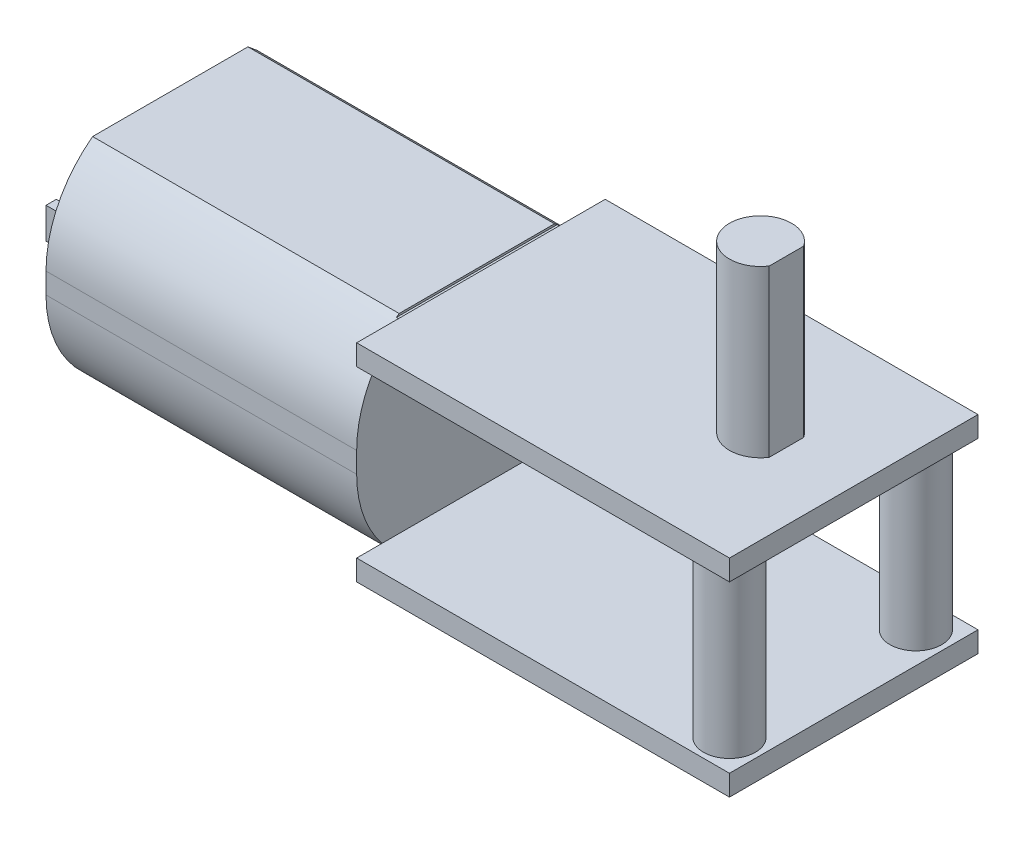
from build123d import *

# Parameters (mm, degrees)
SKETCH1_W           = 18
SKETCH1_H           = 12
BOSS_EXTRUDE1_DEPTH = 1
SKETCH2_R           = 1.25
BOSS_EXTRUDE2_DEPTH = 8
SKETCH3_W           = 18
SKETCH3_H           = 12
BOSS_EXTRUDE3_DEPTH = 1
BOSS_EXTRUDE4_DEPTH = 15
SKETCH5_R           = 2.5
SKETCH5_R_2         = 0.5
BOSS_EXTRUDE5_DEPTH = 1
SKETCH6_W           = 0.5
SKETCH6_H           = 1.5
BOSS_EXTRUDE6_DEPTH = 2.5
BOSS_EXTRUDE7_DEPTH = 8
SKETCH8_W           = 0.2
SKETCH8_H           = 0.1
CUT_EXTRUDE1_DEPTH  = 35.208916966


with BuildPart() as part:
    # Sketch1 → Boss-Extrude1 (new body)
    with BuildSketch(Plane(origin=(0, 0, 0), x_dir=(1, 0, 0), z_dir=(0, 1, 0))):
        Rectangle(SKETCH1_W, SKETCH1_H)
    extrude(amount=BOSS_EXTRUDE1_DEPTH)

    # Sketch2 → Boss-Extrude2 (add)
    with BuildSketch(Plane(origin=(0, 1, 0), x_dir=(1, 0, 0), z_dir=(0, 1, 0))):
        with Locations(Location((7.5, 4.5, 0), (0, 0, 90))):
            Circle(SKETCH2_R)
        with Locations(Location((7.5, -4.5, 0), (0, 0, 90))):
            Circle(SKETCH2_R)
    extrude(amount=BOSS_EXTRUDE2_DEPTH)

    # Sketch3 → Boss-Extrude3 (add)
    with BuildSketch(Plane(origin=(0, 9, 0), x_dir=(1, 0, 0), z_dir=(0, 1, 0))):
        Rectangle(SKETCH3_W, SKETCH3_H)
    extrude(amount=BOSS_EXTRUDE3_DEPTH)

    # Sketch4 → Boss-Extrude4 (add)
    with BuildSketch(Plane.ZY.offset(9)):
        with BuildLine():
            Line((-3.75, 0), (3.75, 0))
            ThreePointArc((3.75, 0), (5.406152949, 1.984423525), (6, 4.5))
            Line((6, 4.5), (6, 5.5))
            ThreePointArc((6, 5.5), (5.406152949, 8.015576475), (3.75, 10))
            Line((3.75, 10), (-3.75, 10))
            ThreePointArc((-3.75, 10), (-5.406152949, 8.015576475), (-6, 5.5))
            Line((-6, 5.5), (-6, 4.5))
            ThreePointArc((-6, 4.5), (-5.406152949, 1.984423525), (-3.75, 0))
        make_face()
    extrude(amount=BOSS_EXTRUDE4_DEPTH)

    # Sketch5 → Boss-Extrude5 (add)
    with BuildSketch(Plane.ZY.offset(24)):
        with Locations((0, 5)):
            Circle(SKETCH5_R)
        with Locations((0, 5)):
            Circle(SKETCH5_R_2, mode=Mode.SUBTRACT)
    extrude(amount=BOSS_EXTRUDE5_DEPTH)

    # Sketch6 → Boss-Extrude6 (add)
    with BuildSketch(Plane.ZY.offset(24)):
        with Locations((-3.25, 5)):
            Rectangle(SKETCH6_W, SKETCH6_H)
        with Locations((3.25, 5)):
            Rectangle(SKETCH6_W, SKETCH6_H)
    extrude(amount=BOSS_EXTRUDE6_DEPTH)

    # Sketch7 → Boss-Extrude7 (add)
    with BuildSketch(Plane(origin=(0, 10, 0), x_dir=(1, 0, 0), z_dir=(0, 1, 0))):
        with BuildLine():
            Line((5.75, -0.829156198), (5.75, 0.829156198))
            ThreePointArc((5.75, 0.829156198), (3, 0), (5.75, -0.829156198))
        make_face()
    extrude(amount=BOSS_EXTRUDE7_DEPTH)

    # Sketch8 → Cut-Extrude1 (cut, through all)
    with BuildSketch(Plane.XY.offset(6)):
        with Locations((-9.1, 9.95)):
            Rectangle(SKETCH8_W, SKETCH8_H)
        with Locations((-9.1, 0.05)):
            Rectangle(SKETCH8_W, SKETCH8_H)
    extrude(amount=-CUT_EXTRUDE1_DEPTH, mode=Mode.SUBTRACT)


solid = part.part
